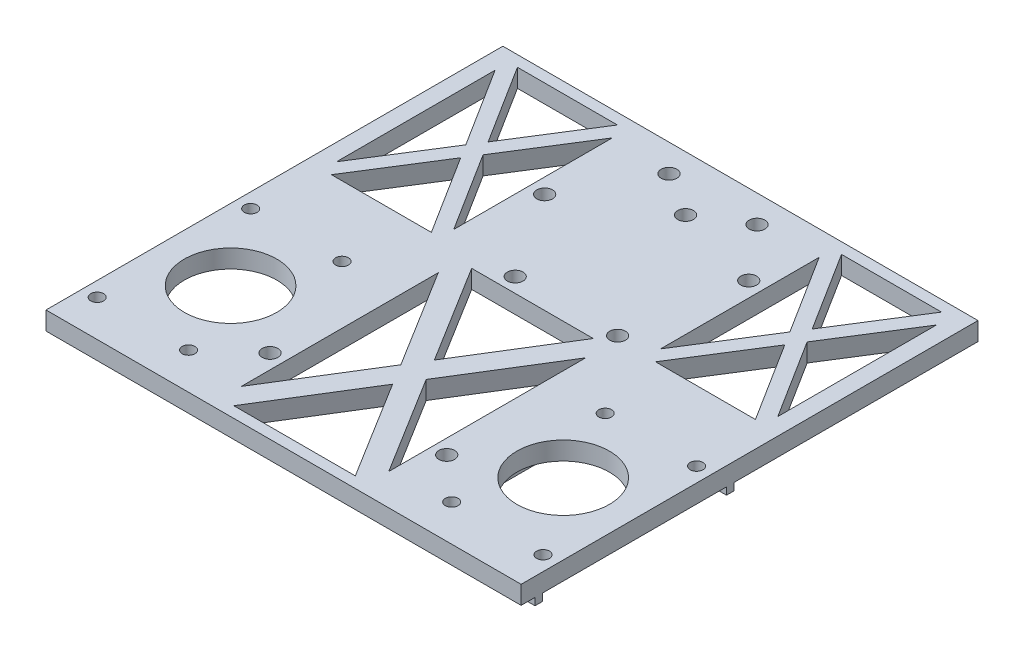
from build123d import *

# Parameters (mm, degrees)
SKETCH1_W           = 130
SKETCH1_H           = 125
BOSS_EXTRUDE1_DEPTH = 5
SKETCH2_R           = 1.75
SKETCH2_R_2         = 12.65
CUT_EXTRUDE1_DEPTH  = 10
SKETCH3_R           = 2.15
CUT_EXTRUDE2_DEPTH  = 10
SKETCH4_R           = 2.15
CUT_EXTRUDE3_DEPTH  = 10
BOSS_EXTRUDE2_DEPTH = 2
SKETCH6_R           = 2.65
CUT_EXTRUDE4_DEPTH  = 0.5
CUT_EXTRUDE5_DEPTH  = 91.311959341
CUT_EXTRUDE6_DEPTH  = 91.311959341


with BuildPart() as part:
    # Sketch1 → Boss-Extrude1 (new body)
    with BuildSketch(Plane(origin=(0, 0, 0), x_dir=(1, 0, 0), z_dir=(0, 1, 0))):
        Rectangle(SKETCH1_W, SKETCH1_H)
    extrude(amount=BOSS_EXTRUDE1_DEPTH)

    # Sketch2 → Cut-Extrude1 (cut)
    with BuildSketch(Plane(origin=(0, 5, 0), x_dir=(1, 0, 0), z_dir=(0, 1, 0))):
        with Locations(Location((-61, -52.5, 0), (0, 0, 270))):
            Circle(SKETCH2_R)
        with Locations(Location((-36, -52.5, 0), (0, 0, 270))):
            Circle(SKETCH2_R)
        with Locations(Location((-36, -10.5, 0), (0, 0, 270))):
            Circle(SKETCH2_R)
        with Locations(Location((-61, -10.5, 0), (0, 0, 270))):
            Circle(SKETCH2_R)
        with Locations(Location((-45.5, -31.5, 0), (0, 0, 270))):
            Circle(SKETCH2_R_2)
    cut_extrude1 = extrude(amount=-CUT_EXTRUDE1_DEPTH, mode=Mode.SUBTRACT)

    # Mirror3: Cut-Extrude1 across plane
    add(cut_extrude1.mirror(Plane.ZY), mode=Mode.SUBTRACT)

    # Sketch3 → Cut-Extrude2 (cut)
    with BuildSketch(Plane(origin=(0, 5, 0), x_dir=(1, 0, 0), z_dir=(0, 1, 0))):
        with Locations(Location((-24.17, -42.03, 0), (0, 0, 270))):
            Circle(SKETCH3_R)
        with Locations(Location((24.17, -42.03, 0), (0, 0, 270))):
            Circle(SKETCH3_R)
        with Locations(Location((-8.73, 9.6, 0), (0, 0, 270))):
            Circle(SKETCH3_R)
        with Locations(Location((19.29, 9.6, 0), (0, 0, 270))):
            Circle(SKETCH3_R)
        with Locations(Location((-24.17, 33.11, 0), (0, 0, 270))):
            Circle(SKETCH3_R)
        with Locations(Location((24.17, 40.6, 0), (0, 0, 270))):
            Circle(SKETCH3_R)
    extrude(amount=-CUT_EXTRUDE2_DEPTH, mode=Mode.SUBTRACT)

    # Sketch4 → Cut-Extrude3 (cut)
    with BuildSketch(Plane(origin=(0, 5, 0), x_dir=(1, 0, 0), z_dir=(0, 1, 0))):
        with Locations(Location((0, 47.5, 0), (0, 0, 270))):
            Circle(SKETCH4_R)
        with Locations(Location((12.049810205, 55, 0), (0, 0, 270))):
            Circle(SKETCH4_R)
        with Locations(Location((-12.049810205, 55, 0), (0, 0, 270))):
            Circle(SKETCH4_R)
    extrude(amount=-CUT_EXTRUDE3_DEPTH, mode=Mode.SUBTRACT)

    # Sketch5 → Boss-Extrude2 (add)
    with BuildSketch(Plane.XZ):
        Polygon((-65, 58.7), (-65, 56.7), (-31.6, 56.7), (-31.6, 6.3), (-65, 6.3), (-65, 4.3), (-29.6, 4.3), (-29.6, 58.7), align=None)
    boss_extrude2 = extrude(amount=BOSS_EXTRUDE2_DEPTH)

    # Mirror5: Boss-Extrude2 across plane
    add(boss_extrude2.mirror(Plane.ZY))

    # Sketch6 → Cut-Extrude4 (cut)
    with BuildSketch(Plane.XZ):
        with Locations(Location((-12.049810205, -55, 0), (0, 0, 270))):
            Circle(SKETCH6_R)
        with Locations(Location((12.049810205, -55, 0), (0, 0, 270))):
            Circle(SKETCH6_R)
        with Locations(Location((0, -47.5, 0), (0, 0, 270))):
            Circle(SKETCH6_R)
        with Locations(Location((24.17, -40.6, 0), (0, 0, 270))):
            Circle(SKETCH6_R)
        with Locations(Location((-24.17, -33.11, 0), (0, 0, 270))):
            Circle(SKETCH6_R)
        with Locations(Location((-8.73, -9.6, 0), (0, 0, 270))):
            Circle(SKETCH6_R)
        with Locations(Location((19.29, -9.6, 0), (0, 0, 270))):
            Circle(SKETCH6_R)
        with Locations(Location((-61, 10.5, 0), (0, 0, 270))):
            Circle(SKETCH6_R)
        with Locations(Location((-61, 52.5, 0), (0, 0, 270))):
            Circle(SKETCH6_R)
        with Locations(Location((-36, 52.5, 0), (0, 0, 270))):
            Circle(SKETCH6_R)
        with Locations(Location((-36, 10.5, 0), (0, 0, 270))):
            Circle(SKETCH6_R)
        with Locations(Location((-24.17, 42.03, 0), (0, 0, 270))):
            Circle(SKETCH6_R)
        with Locations(Location((24.17, 42.03, 0), (0, 0, 270))):
            Circle(SKETCH6_R)
        with Locations(Location((36, 52.5, 0), (0, 0, 270))):
            Circle(SKETCH6_R)
        with Locations(Location((36, 10.5, 0), (0, 0, 270))):
            Circle(SKETCH6_R)
        with Locations(Location((61, 10.5, 0), (0, 0, 270))):
            Circle(SKETCH6_R)
        with Locations(Location((61, 52.5, 0), (0, 0, 270))):
            Circle(SKETCH6_R)
    extrude(amount=-CUT_EXTRUDE4_DEPTH, mode=Mode.SUBTRACT)

    # Sketch7 → Cut-Extrude5 (cut, through all)
    with BuildSketch(Plane.XZ):
        Polygon((-3.470107527, 26.95), (-20.17, 53.9), (-20.17, 0), align=None)
        Polygon((16.629937096, 59.5), (-16.629937096, 59.5), (0, 32.662892788), align=None)
        Polygon((20.17, 0), (20.17, 53.9), (3.470107527, 26.95), align=None)
        Polygon((0, 21.237107212), (-16.629937096, -5.6), (16.629937096, -5.6), align=None)
    extrude(amount=-CUT_EXTRUDE5_DEPTH, mode=Mode.SUBTRACT)

    # Sketch8 → Cut-Extrude6 (cut, through all)
    with BuildSketch(Plane.XZ):
        Polygon((-46.699325365, -34.05), (-60.372350745, -12.351497003), (-60.372350745, -55.748502997), align=None)
        Polygon((-30.662343644, -8.6), (-58.008394405, -8.6), (-44.335369025, -30.298502997), align=None)
        Polygon((-28.298387304, -55.748502997), (-28.298387304, -12.351497003), (-41.971412684, -34.05), align=None)
        Polygon((-44.335369025, -37.801497003), (-58.008394405, -59.5), (-30.662343644, -59.5), align=None)
        Polygon((41.971412684, -34.05), (28.298387304, -12.351497003), (28.298387304, -55.748502997), align=None)
        Polygon((44.335369025, -30.298502997), (58.008394405, -8.6), (30.662343644, -8.6), align=None)
        Polygon((60.372350745, -12.351497003), (46.699325365, -34.05), (60.372350745, -55.748502997), align=None)
        Polygon((30.662343644, -59.5), (58.008394405, -59.5), (44.335369025, -37.801497003), align=None)
    extrude(amount=-CUT_EXTRUDE6_DEPTH, mode=Mode.SUBTRACT)


solid = part.part
